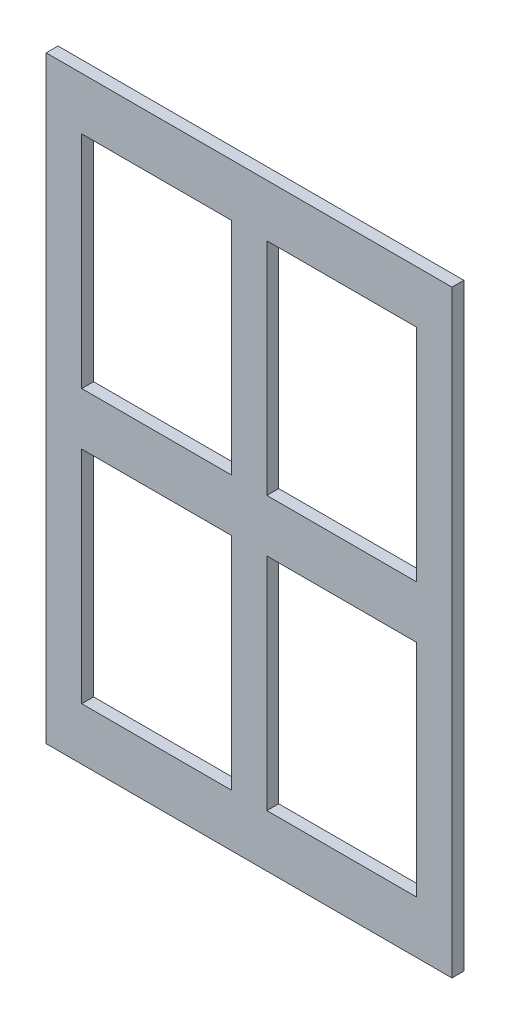
from build123d import *

# Parameters (mm, degrees)
SKETCH1_W           = 137
SKETCH1_H           = 202
SKETCH1_W_2         = 50.5
SKETCH1_H_2         = 74.459854015
BOSS_EXTRUDE1_DEPTH = 4


with BuildPart() as part:
    # Sketch1 → Boss-Extrude1 (new body)
    with BuildSketch(Plane.XY):
        Rectangle(SKETCH1_W, SKETCH1_H)
        with Locations((-31.25, 46.076642336)):
            Rectangle(SKETCH1_W_2, SKETCH1_H_2, mode=Mode.SUBTRACT)
        with Locations((31.25, 46.076642336)):
            Rectangle(SKETCH1_W_2, SKETCH1_H_2, mode=Mode.SUBTRACT)
        with Locations((-31.25, -46.076642336)):
            Rectangle(SKETCH1_W_2, SKETCH1_H_2, mode=Mode.SUBTRACT)
        with Locations((31.25, -46.076642336)):
            Rectangle(SKETCH1_W_2, SKETCH1_H_2, mode=Mode.SUBTRACT)
    extrude(amount=BOSS_EXTRUDE1_DEPTH)


solid = part.part
